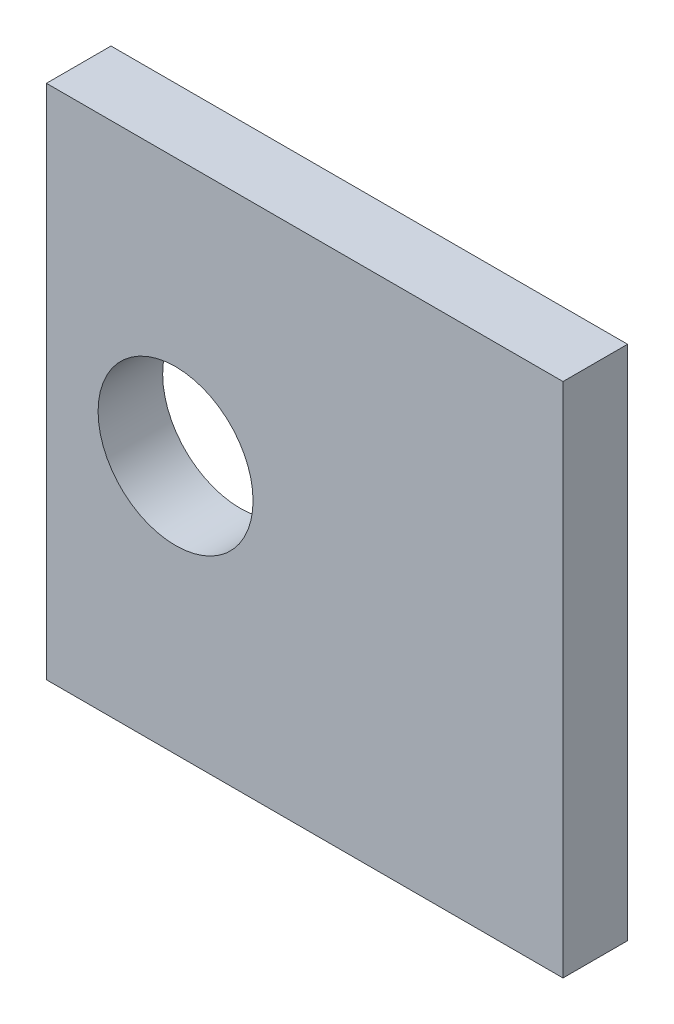
from build123d import *

# Parameters (mm, degrees)
SKETCH1_W           = 40
SKETCH1_H           = 40
SKETCH1_R           = 6
BOSS_EXTRUDE1_DEPTH = 5


with BuildPart() as part:
    # Sketch1 → Boss-Extrude1 (new body)
    with BuildSketch(Plane.XY):
        Rectangle(SKETCH1_W, SKETCH1_H)
        with Locations((-10, 0)):
            Circle(SKETCH1_R, mode=Mode.SUBTRACT)
    extrude(amount=BOSS_EXTRUDE1_DEPTH)


solid = part.part
